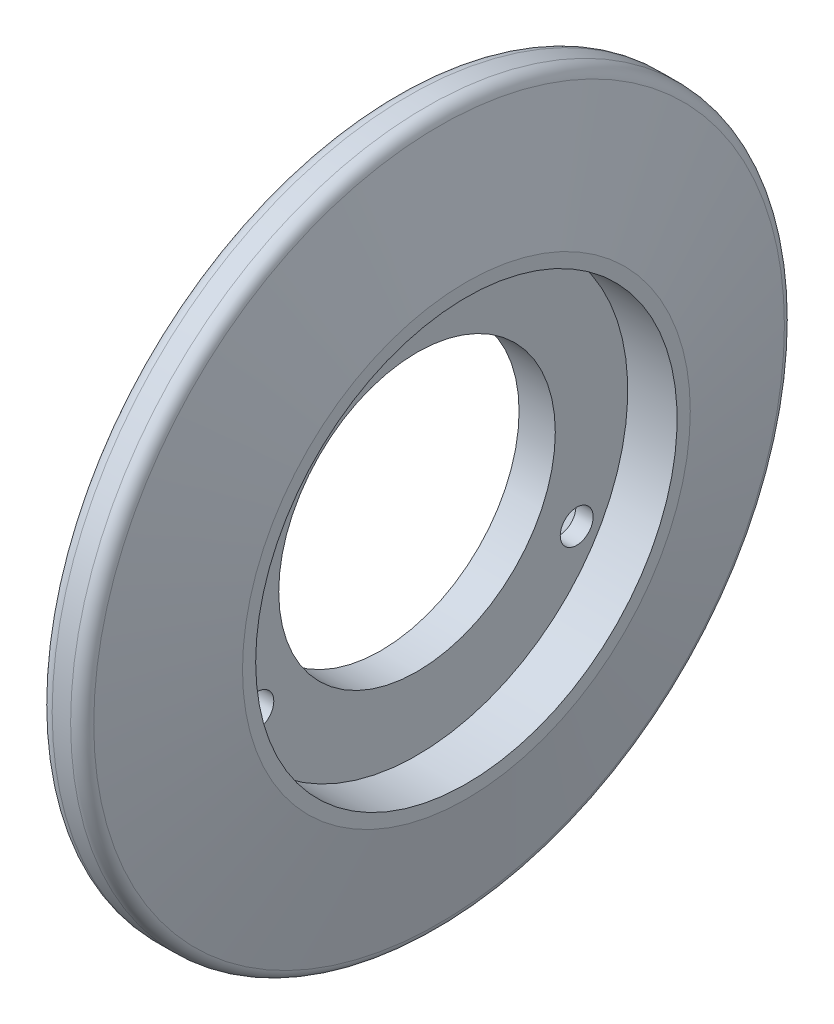
from build123d import *

# Parameters (mm, degrees)
CONG_1_R                     = 2
PER_AGE1_D                   = 5
PER_AGE1_DEPTH               = 20
PER_AGE1_CSINK_D             = 10
PER_AGE1_CSINK_ANGLE         = 82
R_P_TITION_CIRCULAIRE1_COUNT = 3


with BuildPart() as part:
    # Esquisse1 → Base-Révolution (revolve)
    with BuildSketch(Plane.XY, mode=Mode.PRIVATE) as base_r_volution_sk:
        Polygon((5.5, -34), (10, -54), (16, -54), (20.5, -34), (20.5, -32), (13, -32), (13, -21), (7.5, -21), (7.5, -33), (5.5, -33), align=None)
    revolve(base_r_volution_sk.sketch.rotate(Axis((-40, 0, 0), (1, 0, 0)), 270), axis=Axis((-40, 0, 0), (1, 0, 0)))

    # Congé1
    cong_1_edges = [part.edges().sort_by_distance(p)[0] for p in [
        (10, 0, -54),
        (16, 0, -54),
    ]]
    fillet(cong_1_edges, radius=CONG_1_R)

    # Perçage1
    with Locations(Plane.ZY.offset(-7.5)):
        with Locations((0, 28)):
            per_age1 = CounterSinkHole(PER_AGE1_D / 2, PER_AGE1_CSINK_D / 2, depth=PER_AGE1_DEPTH, counter_sink_angle=PER_AGE1_CSINK_ANGLE)

    # Répétition circulaire1: Perçage1 ×3 about axis
    r_p_tition_circulaire1_axis = Axis((10, 0, 0), (-1, 0, 0))
    for i in range(1, R_P_TITION_CIRCULAIRE1_COUNT):
        add(per_age1.rotate(r_p_tition_circulaire1_axis, i * 360 / R_P_TITION_CIRCULAIRE1_COUNT), mode=Mode.SUBTRACT)


solid = part.part
